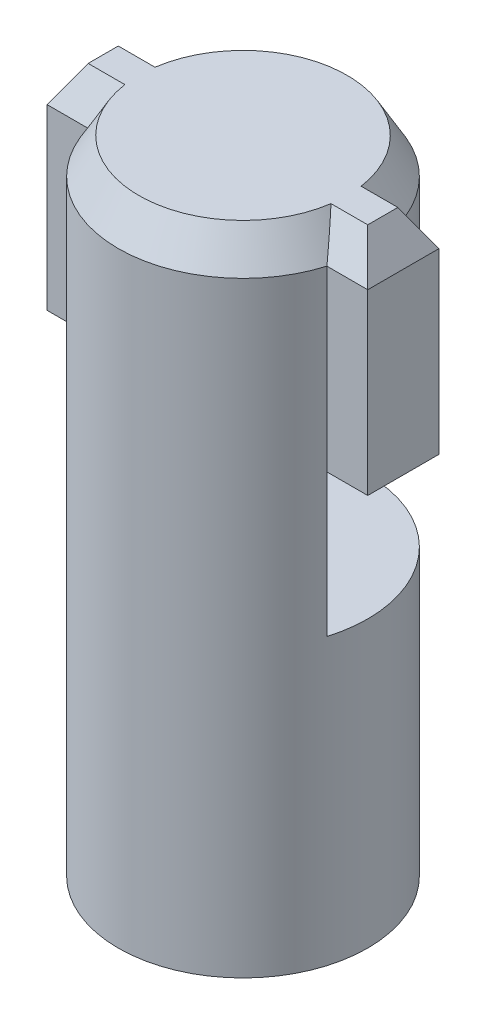
from build123d import *
from OCP.BRepFilletAPI import BRepFilletAPI_MakeChamfer

# Parameters (mm, degrees)
SKETCH1_R           = 3.5
BOSS_EXTRUDE1_DEPTH = 18
SKETCH2_W           = 9
SKETCH2_H           = 2
BOSS_EXTRUDE3_DEPTH = 10
CUT_EXTRUDE3_START  = -8
SKETCH3_W           = 10
SKETCH3_H           = 4.5
CUT_EXTRUDE3_DEPTH  = 4
CHAMFER1_SIZE       = 1
CHAMFER1_SIZE2      = 0.577350269


with BuildPart() as part:
    # Sketch1 → Boss-Extrude1 (new body)
    with BuildSketch(Plane(origin=(0, 0, 0), x_dir=(1, 0, 0), z_dir=(0, 1, 0))):
        with Locations(Location((0, 0, 0), (0, 0, 270))):
            Circle(SKETCH1_R)
    extrude(amount=BOSS_EXTRUDE1_DEPTH)

    # Sketch2 → Boss-Extrude3 (add)
    with BuildSketch(Plane(origin=(0, 18, 0), x_dir=(1, 0, 0), z_dir=(0, 1, 0))):
        Rectangle(SKETCH2_W, SKETCH2_H)
    extrude(amount=-BOSS_EXTRUDE3_DEPTH)

    # Sketch3 → Cut-Extrude3 (cut)
    with BuildSketch(Plane.XZ.offset(CUT_EXTRUDE3_START)):
        with Locations((0, -1.25)):
            Rectangle(SKETCH3_W, SKETCH3_H)
    extrude(amount=-CUT_EXTRUDE3_DEPTH, mode=Mode.SUBTRACT)

    # Chamfer1: one chamfer whose edges measure the first distance from different faces: ONE call of the kernel's chamfer builder (chamfer() names one face for all edges)
    chamfer1_edges_1 = [part.edges().sort_by_distance(p)[0] for p in [
        (3.927050983, 18, -1),
    ]]
    chamfer1_side_1 = [part.faces().sort_by_distance(p)[0] for p in [
        (3.927050983, 15, -1),
    ]]
    chamfer1_edges_2 = [part.edges().sort_by_distance(p)[0] for p in [
        (3.927050983, 18, 1),
    ]]
    chamfer1_side_2 = [part.faces().sort_by_distance(p)[0] for p in [
        (3.927050983, 15, 1),
    ]]
    chamfer1_edges_3 = [part.edges().sort_by_distance(p)[0] for p in [
        (4.5, 18, 0),
    ]]
    chamfer1_side_3 = [part.faces().sort_by_distance(p)[0] for p in [
        (4.5, 15, 0),
    ]]
    chamfer1_edges_4 = [part.edges().sort_by_distance(p)[0] for p in [
        (-3.927050983, 18, 1),
    ]]
    chamfer1_side_4 = [part.faces().sort_by_distance(p)[0] for p in [
        (-3.927050983, 15, 1),
    ]]
    chamfer1_edges_5 = [part.edges().sort_by_distance(p)[0] for p in [
        (-3.927050983, 18, -1),
    ]]
    chamfer1_side_5 = [part.faces().sort_by_distance(p)[0] for p in [
        (-3.927050983, 15, -1),
    ]]
    chamfer1_edges_6 = [part.edges().sort_by_distance(p)[0] for p in [
        (-4.5, 18, 0),
    ]]
    chamfer1_side_6 = [part.faces().sort_by_distance(p)[0] for p in [
        (-4.5, 15, 0),
    ]]
    chamfer1_edges_7 = [part.edges().sort_by_distance(p)[0] for p in [
        (0, 18, -3.5),
    ]]
    chamfer1_side_7 = [part.faces().sort_by_distance(p)[0] for p in [
        (0, 15, -3.5),
    ]]
    chamfer1_edges_8 = [part.edges().sort_by_distance(p)[0] for p in [
        (2.091650066, 18, 2.80624304),
    ]]
    chamfer1_side_8 = [part.faces().sort_by_distance(p)[0] for p in [
        (0, 9, -3.5),
    ]]
    chamfer1 = BRepFilletAPI_MakeChamfer(part.part.solid().wrapped)
    for e in chamfer1_edges_1:
        chamfer1.Add(CHAMFER1_SIZE, CHAMFER1_SIZE2, e.wrapped, chamfer1_side_1[0].wrapped)  # the first distance lies on this face
    for e in chamfer1_edges_2:
        chamfer1.Add(CHAMFER1_SIZE, CHAMFER1_SIZE2, e.wrapped, chamfer1_side_2[0].wrapped)  # the first distance lies on this face
    for e in chamfer1_edges_3:
        chamfer1.Add(CHAMFER1_SIZE, CHAMFER1_SIZE2, e.wrapped, chamfer1_side_3[0].wrapped)  # the first distance lies on this face
    for e in chamfer1_edges_4:
        chamfer1.Add(CHAMFER1_SIZE, CHAMFER1_SIZE2, e.wrapped, chamfer1_side_4[0].wrapped)  # the first distance lies on this face
    for e in chamfer1_edges_5:
        chamfer1.Add(CHAMFER1_SIZE, CHAMFER1_SIZE2, e.wrapped, chamfer1_side_5[0].wrapped)  # the first distance lies on this face
    for e in chamfer1_edges_6:
        chamfer1.Add(CHAMFER1_SIZE, CHAMFER1_SIZE2, e.wrapped, chamfer1_side_6[0].wrapped)  # the first distance lies on this face
    for e in chamfer1_edges_7:
        chamfer1.Add(CHAMFER1_SIZE, CHAMFER1_SIZE2, e.wrapped, chamfer1_side_7[0].wrapped)  # the first distance lies on this face
    for e in chamfer1_edges_8:
        chamfer1.Add(CHAMFER1_SIZE, CHAMFER1_SIZE2, e.wrapped, chamfer1_side_8[0].wrapped)  # the first distance lies on this face
    add(Compound.cast(chamfer1.Shape()), mode=Mode.REPLACE)


solid = part.part
